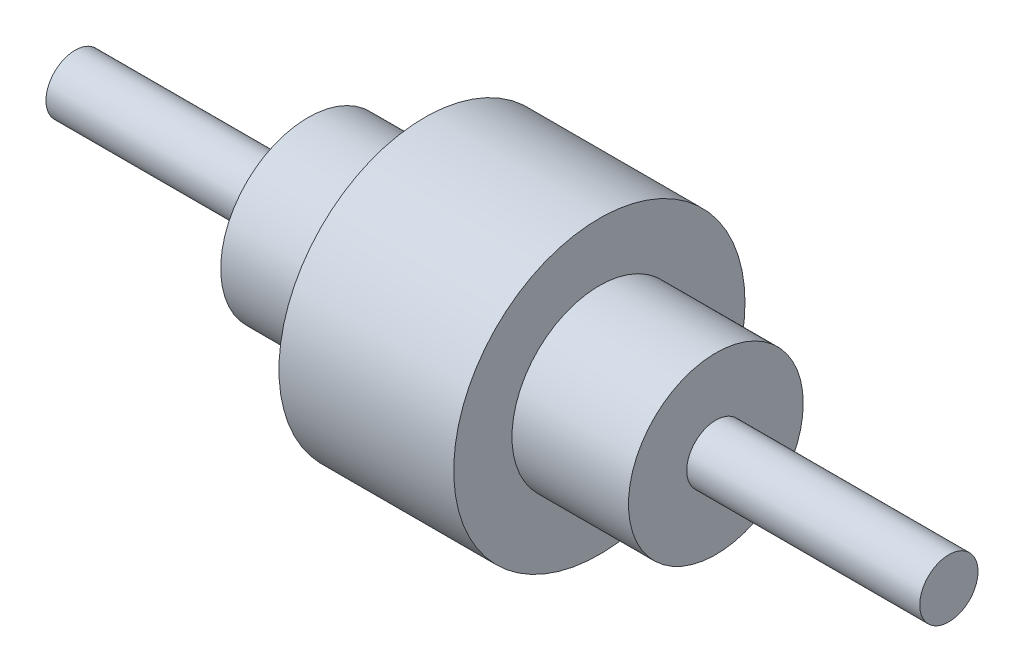
from build123d import *

# Parameters (mm, degrees)
SKETCH1_R           = 254
BOSS_EXTRUDE1_DEPTH = 2032
SKETCH3_R           = 762
BOSS_EXTRUDE2_DEPTH = 1016
SKETCH4_R           = 1270
BOSS_EXTRUDE3_DEPTH = 1524
SKETCH5_R           = 762
BOSS_EXTRUDE4_DEPTH = 1016
SKETCH6_R           = 254
BOSS_EXTRUDE5_DEPTH = 2032


with BuildPart() as part:
    # Sketch1 → Boss-Extrude1 (new body)
    with BuildSketch(Plane(origin=(0, 0, 0), x_dir=(0, 0, -1), z_dir=(1, 0, 0))):
        Circle(SKETCH1_R)
    extrude(amount=BOSS_EXTRUDE1_DEPTH)

    # Sketch3 → Boss-Extrude2 (add)
    with BuildSketch(Plane(origin=(2032, 0, 0), x_dir=(0, 0, -1), z_dir=(1, 0, 0))):
        Circle(SKETCH3_R)
    extrude(amount=BOSS_EXTRUDE2_DEPTH)

    # Sketch4 → Boss-Extrude3 (add)
    with BuildSketch(Plane(origin=(3048, 0, 0), x_dir=(0, 0, -1), z_dir=(1, 0, 0))):
        Circle(SKETCH4_R)
    extrude(amount=BOSS_EXTRUDE3_DEPTH)

    # Sketch5 → Boss-Extrude4 (add)
    with BuildSketch(Plane(origin=(4572, 0, 0), x_dir=(0, 0, -1), z_dir=(1, 0, 0))):
        Circle(SKETCH5_R)
    extrude(amount=BOSS_EXTRUDE4_DEPTH)

    # Sketch6 → Boss-Extrude5 (add)
    with BuildSketch(Plane(origin=(5588, 0, 0), x_dir=(0, 0, -1), z_dir=(1, 0, 0))):
        Circle(SKETCH6_R)
    extrude(amount=BOSS_EXTRUDE5_DEPTH)


solid = part.part
